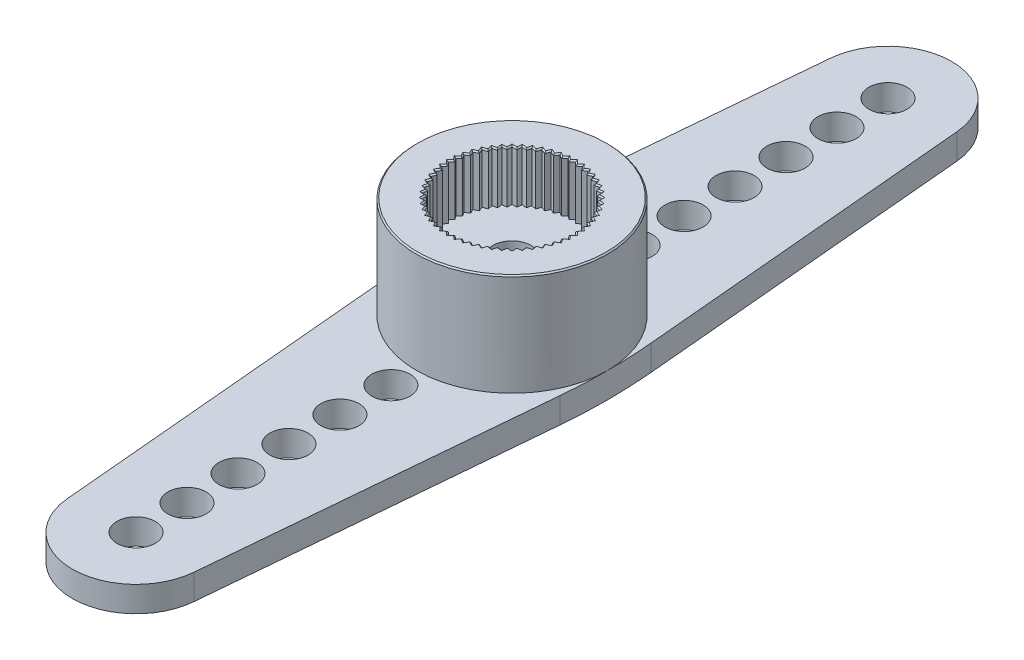
from build123d import *

# Parameters (mm, degrees)
SKETCH1_R           = 0.75
BOSS_EXTRUDE1_DEPTH = 1
SKETCH2_R           = 1.5
CUT_EXTRUDE1_DEPTH  = 1
SKETCH2_3_R         = 3.75
BOSS_EXTRUDE2_DEPTH = 4
SKETCH1_2_R         = 0.75
CUT_EXTRUDE2_DEPTH  = 19.347343132
CUT_EXTRUDE3_START  = -2
SKETCH3_R           = 0.75
CUT_EXTRUDE3_DEPTH  = 2
CHAMFER1_SIZE       = 0.05


with BuildPart() as part:
    # Sketch1 → Boss-Extrude1 (new body)
    with BuildSketch(Plane(origin=(0, 0, 0), x_dir=(1, 0, 0), z_dir=(0, 1, 0))):
        with BuildLine():
            Line((-3.670399021, 1.782611249), (-2.490049878, 14.972826406))
            ThreePointArc((-2.490049878, 14.972826406), (0, 17.25), (2.490049878, 14.972826406))
            Line((2.490049878, 14.972826406), (3.670399021, 1.782611249))
            ThreePointArc((3.670399021, 1.782611249), (3.75, 0), (3.670399021, -1.782611249))
            Line((3.670399021, -1.782611249), (2.490049878, -14.972826406))
            ThreePointArc((2.490049878, -14.972826406), (0, -17.25), (-2.490049878, -14.972826406))
            Line((-2.490049878, -14.972826406), (-3.670399021, -1.782611249))
            ThreePointArc((-3.670399021, -1.782611249), (-3.75, 0), (-3.670399021, 1.782611249))
        make_face()
        with Locations(Location((0, 14.75, 0), (0, 0, 270))):
            Circle(SKETCH1_R, mode=Mode.SUBTRACT)
        with Locations(Location((0, 12.75, 0), (0, 0, 270))):
            Circle(SKETCH1_R, mode=Mode.SUBTRACT)
        with Locations(Location((0, 10.75, 0), (0, 0, 270))):
            Circle(SKETCH1_R, mode=Mode.SUBTRACT)
        with Locations(Location((0, 8.75, 0), (0, 0, 270))):
            Circle(SKETCH1_R, mode=Mode.SUBTRACT)
        with Locations(Location((0, 6.75, 0), (0, 0, 270))):
            Circle(SKETCH1_R, mode=Mode.SUBTRACT)
        with Locations(Location((0, 4.75, 0), (0, 0, 270))):
            Circle(SKETCH1_R, mode=Mode.SUBTRACT)
        with Locations(Location((0, 0, 0), (0, 0, 270))):
            Circle(SKETCH1_R, mode=Mode.SUBTRACT)
        with Locations(Location((0, -4.75, 0), (0, 0, 90))):
            Circle(SKETCH1_R, mode=Mode.SUBTRACT)
        with Locations(Location((0, -6.75, 0), (0, 0, 90))):
            Circle(SKETCH1_R, mode=Mode.SUBTRACT)
        with Locations(Location((0, -8.75, 0), (0, 0, 90))):
            Circle(SKETCH1_R, mode=Mode.SUBTRACT)
        with Locations(Location((0, -10.75, 0), (0, 0, 90))):
            Circle(SKETCH1_R, mode=Mode.SUBTRACT)
        with Locations(Location((0, -12.75, 0), (0, 0, 90))):
            Circle(SKETCH1_R, mode=Mode.SUBTRACT)
        with Locations(Location((0, -14.75, 0), (0, 0, 90))):
            Circle(SKETCH1_R, mode=Mode.SUBTRACT)
    extrude(amount=BOSS_EXTRUDE1_DEPTH)

    # Sketch2 → Cut-Extrude1 (cut)
    with BuildSketch(Plane(origin=(0, 1, 0), x_dir=(1, 0, 0), z_dir=(0, 1, 0))):
        with Locations(Location((0, 0, 0), (0, 0, 270))):
            Circle(SKETCH2_R)
    extrude(amount=-CUT_EXTRUDE1_DEPTH, mode=Mode.SUBTRACT)

    # Sketch2<3> → Boss-Extrude2 (add)
    with BuildSketch(Plane(origin=(0, 1, 0), x_dir=(1, 0, 0), z_dir=(0, 1, 0))):
        with Locations(Location((0, 0, 0), (0, 0, 180))):
            Circle(SKETCH2_3_R)
    extrude(amount=BOSS_EXTRUDE2_DEPTH)

    # Sketch1<2> → Cut-Extrude2 (cut, through all)
    with BuildSketch(Plane(origin=(0, 0, 0), x_dir=(1, 0, 0), z_dir=(0, 1, 0))):
        with Locations(Location((0, 0, 0), (0, 0, 270))):
            Circle(SKETCH1_2_R)
    extrude(amount=CUT_EXTRUDE2_DEPTH, mode=Mode.SUBTRACT)

    # Sketch3 → Cut-Extrude3 (cut)
    with BuildSketch(Plane(origin=(0, 5, 0), x_dir=(1, 0, 0), z_dir=(0, 1, 0)).offset(CUT_EXTRUDE3_START)):
        Polygon((0.132931704, 2.367068296), (0, 2.5), (-0.132931704, 2.367068296), (-0.27991119, 2.484280525), (-0.397123419, 2.337301039), (-0.556302335, 2.43731978), (-0.656321077, 2.278140865), (-0.825697655, 2.359708326), (-0.907265116, 2.190331748), (-1.084709348, 2.25242217), (-1.14679977, 2.074977938), (-1.330080191, 2.116810498), (-1.371912751, 1.933530077), (-1.558724505, 1.954578706), (-1.579773134, 1.767766953), (-1.767766953, 1.767766953), (-1.767766953, 1.579773134), (-1.954578706, 1.558724505), (-1.933530077, 1.371912751), (-2.116810498, 1.330080191), (-2.074977938, 1.14679977), (-2.25242217, 1.084709348), (-2.190331748, 0.907265116), (-2.359708326, 0.825697655), (-2.278140865, 0.656321077), (-2.43731978, 0.556302335), (-2.337301039, 0.397123419), (-2.484280525, 0.27991119), (-2.367068296, 0.132931704), (-2.5, 0), (-2.367068296, -0.132931704), (-2.484280525, -0.27991119), (-2.337301039, -0.397123419), (-2.43731978, -0.556302335), (-2.278140865, -0.656321077), (-2.359708326, -0.825697655), (-2.190331748, -0.907265116), (-2.25242217, -1.084709348), (-2.074977938, -1.14679977), (-2.116810498, -1.330080191), (-1.933530077, -1.371912751), (-1.954578706, -1.558724505), (-1.767766953, -1.579773134), (-1.767766953, -1.767766953), (-1.579773134, -1.767766953), (-1.558724505, -1.954578706), (-1.371912751, -1.933530077), (-1.330080191, -2.116810498), (-1.14679977, -2.074977938), (-1.084709348, -2.25242217), (-0.907265116, -2.190331748), (-0.825697655, -2.359708326), (-0.656321077, -2.278140865), (-0.556302335, -2.43731978), (-0.397123419, -2.337301039), (-0.27991119, -2.484280525), (-0.132931704, -2.367068296), (0, -2.5), (0.132931704, -2.367068296), (0.27991119, -2.484280525), (0.397123419, -2.337301039), (0.556302335, -2.43731978), (0.656321077, -2.278140865), (0.825697655, -2.359708326), (0.907265116, -2.190331748), (1.084709348, -2.25242217), (1.14679977, -2.074977938), (1.330080191, -2.116810498), (1.371912751, -1.933530077), (1.558724505, -1.954578706), (1.579773134, -1.767766953), (1.767766953, -1.767766953), (1.767766953, -1.579773134), (1.954578706, -1.558724505), (1.933530077, -1.371912751), (2.116810498, -1.330080191), (2.074977938, -1.14679977), (2.25242217, -1.084709348), (2.190331748, -0.907265116), (2.359708326, -0.825697655), (2.278140865, -0.656321077), (2.43731978, -0.556302335), (2.337301039, -0.397123419), (2.484280525, -0.27991119), (2.367068296, -0.132931704), (2.5, 0), (2.367068296, 0.132931704), (2.484280525, 0.27991119), (2.337301039, 0.397123419), (2.43731978, 0.556302335), (2.278140865, 0.656321077), (2.359708326, 0.825697655), (2.190331748, 0.907265116), (2.25242217, 1.084709348), (2.074977938, 1.14679977), (2.116810498, 1.330080191), (1.933530077, 1.371912751), (1.954578706, 1.558724505), (1.767766953, 1.579773134), (1.767766953, 1.767766953), (1.579773134, 1.767766953), (1.558724505, 1.954578706), (1.371912751, 1.933530077), (1.330080191, 2.116810498), (1.14679977, 2.074977938), (1.084709348, 2.25242217), (0.907265116, 2.190331748), (0.825697655, 2.359708326), (0.656321077, 2.278140865), (0.556302335, 2.43731978), (0.397123419, 2.337301039), (0.27991119, 2.484280525), align=None)
        Circle(SKETCH3_R, mode=Mode.SUBTRACT)
    extrude(amount=CUT_EXTRUDE3_DEPTH, mode=Mode.SUBTRACT)

    # Chamfer1
    chamfer1_edges = [part.edges().sort_by_distance(p)[0] for p in [
        (-0.206421447, 5, -2.42567441),
        (0.066465852, 5, -2.433534148),
        (0.338517305, 5, -2.410790782),
        (0.606311706, 5, -2.357730323),
        (0.866481385, 5, -2.275020037),
        (1.115754559, 5, -2.163700054),
        (1.350996471, 5, -2.025170287),
        (1.569248819, 5, -1.86117283),
        (1.767766953, 5, -1.673770044),
        (1.944054391, 5, -1.465318628),
        (2.095894218, 5, -1.238439981),
        (2.221376959, 5, -0.995987232),
        (2.318924595, 5, -0.741009366),
        (2.38731041, 5, -0.476712877),
        (2.42567441, 5, -0.206421447),
        (2.433534148, 5, 0.066465852),
        (2.410790782, 5, 0.338517305),
        (2.357730323, 5, 0.606311706),
        (2.275020037, 5, 0.866481385),
        (2.163700054, 5, 1.115754559),
        (2.025170287, 5, 1.350996471),
        (1.86117283, 5, 1.569248819),
        (1.673770044, 5, 1.767766953),
        (1.465318628, 5, 1.944054391),
        (1.238439981, 5, 2.095894218),
        (0.995987232, 5, 2.221376959),
        (0.741009366, 5, 2.318924595),
        (0.476712877, 5, 2.38731041),
        (0.206421447, 5, 2.42567441),
        (-0.066465852, 5, 2.433534148),
        (-0.338517305, 5, 2.410790782),
        (-0.606311706, 5, 2.357730323),
        (-0.866481385, 5, 2.275020037),
        (-1.115754559, 5, 2.163700054),
        (-1.350996471, 5, 2.025170287),
        (-1.569248819, 5, 1.86117283),
        (-1.767766953, 5, 1.673770044),
        (-1.944054391, 5, 1.465318628),
        (-2.095894218, 5, 1.238439981),
        (-2.221376959, 5, 0.995987232),
        (-2.318924595, 5, 0.741009366),
        (-2.38731041, 5, 0.476712877),
        (-2.42567441, 5, 0.206421447),
        (-2.433534148, 5, -0.066465852),
        (-2.410790782, 5, -0.338517305),
        (-2.357730323, 5, -0.606311706),
        (-2.275020037, 5, -0.866481385),
        (-2.163700054, 5, -1.115754559),
        (-2.025170287, 5, -1.350996471),
        (-1.86117283, 5, -1.569248819),
        (-1.673770044, 5, -1.767766953),
        (-1.465318628, 5, -1.944054391),
        (-1.238439981, 5, -2.095894218),
        (-0.995987232, 5, -2.221376959),
        (-0.741009366, 5, -2.318924595),
        (-0.476712877, 5, -2.38731041),
        (-0.338517305, 5, -2.410790782),
        (-0.606311706, 5, -2.357730323),
        (-0.866481385, 5, -2.275020037),
        (-1.115754559, 5, -2.163700054),
        (-1.350996471, 5, -2.025170287),
        (-1.569248819, 5, -1.86117283),
        (-1.767766953, 5, -1.673770044),
        (-1.944054391, 5, -1.465318628),
        (-2.095894218, 5, -1.238439981),
        (-2.221376959, 5, -0.995987232),
        (-2.318924595, 5, -0.741009366),
        (-2.38731041, 5, -0.476712877),
        (-2.42567441, 5, -0.206421447),
        (-2.433534148, 5, 0.066465852),
        (-2.410790782, 5, 0.338517305),
        (-2.357730323, 5, 0.606311706),
        (-2.275020037, 5, 0.866481385),
        (-2.163700054, 5, 1.115754559),
        (-2.025170287, 5, 1.350996471),
        (-1.86117283, 5, 1.569248819),
        (-1.673770044, 5, 1.767766953),
        (-1.465318628, 5, 1.944054391),
        (-1.238439981, 5, 2.095894218),
        (-0.995987232, 5, 2.221376959),
        (-0.741009366, 5, 2.318924595),
        (-0.476712877, 5, 2.38731041),
        (-0.206421447, 5, 2.42567441),
        (0.066465852, 5, 2.433534148),
        (0.338517305, 5, 2.410790782),
        (0.606311706, 5, 2.357730323),
        (0.866481385, 5, 2.275020037),
        (1.115754559, 5, 2.163700054),
        (1.350996471, 5, 2.025170287),
        (1.569248819, 5, 1.86117283),
        (1.767766953, 5, 1.673770044),
        (1.944054391, 5, 1.465318628),
        (2.095894218, 5, 1.238439981),
        (2.221376959, 5, 0.995987232),
        (2.318924595, 5, 0.741009366),
        (2.38731041, 5, 0.476712877),
        (2.42567441, 5, 0.206421447),
        (2.433534148, 5, -0.066465852),
        (2.410790782, 5, -0.338517305),
        (2.357730323, 5, -0.606311706),
        (2.275020037, 5, -0.866481385),
        (2.163700054, 5, -1.115754559),
        (2.025170287, 5, -1.350996471),
        (1.86117283, 5, -1.569248819),
        (1.673770044, 5, -1.767766953),
        (1.465318628, 5, -1.944054391),
        (1.238439981, 5, -2.095894218),
        (0.995987232, 5, -2.221376959),
        (0.741009366, 5, -2.318924595),
        (0.476712877, 5, -2.38731041),
        (0.206421447, 5, -2.42567441),
        (-0.066465852, 5, -2.433534148),
        (3.75, 5, 0),
    ]]
    chamfer(chamfer1_edges, length=CHAMFER1_SIZE)


solid = part.part
